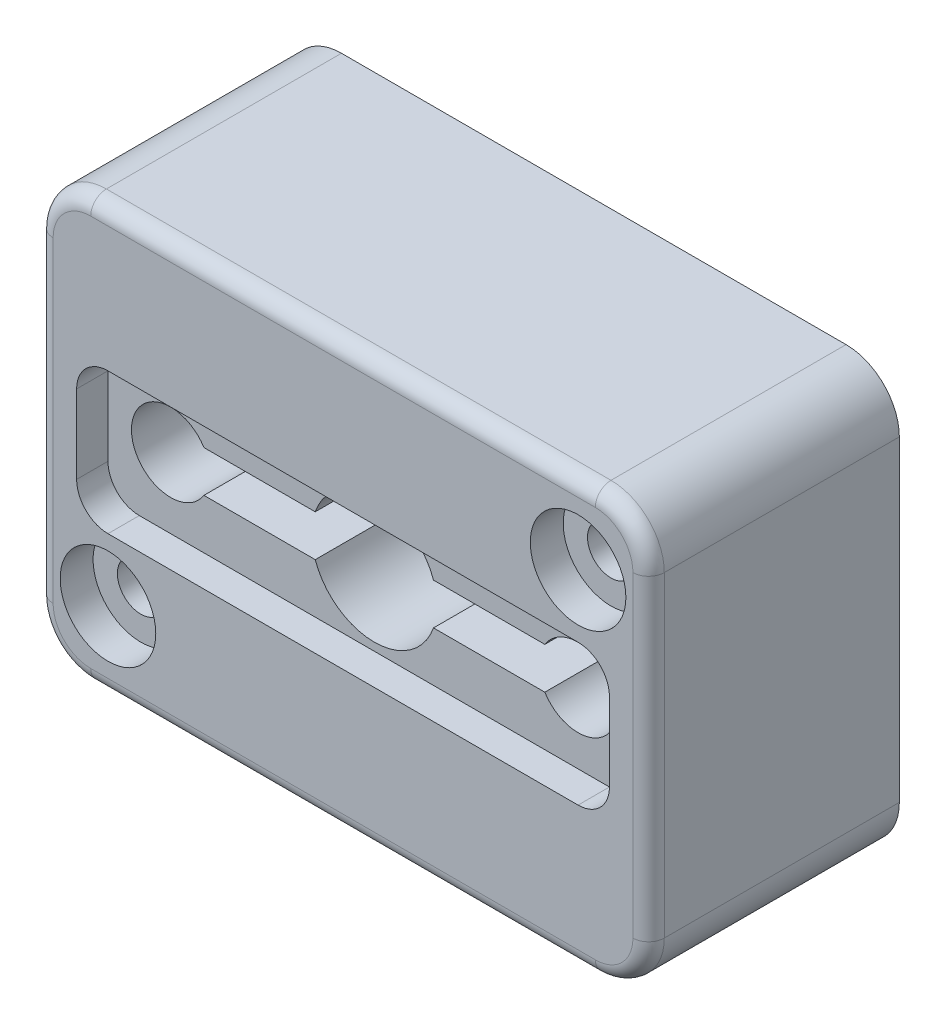
from build123d import *

# Parameters (mm, degrees)
SKIZZE1_R                       = 1.5
AUFSATZ_LINEAR_AUSTRAGEN1_DEPTH = 16
SCHNITT_LINEAR_AUSTRAGEN1_DEPTH = 2
SKIZZE3_R                       = 2.5
SCHNITT_LINEAR_AUSTRAGEN2_DEPTH = 7
SKIZZE4_R                       = 3.05
SCHNITT_LINEAR_AUSTRAGEN3_DEPTH = 2.1
VERRUNDUNG1_R                   = 1
SKIZZE5_R                       = 3.997213622
SCHNITT_LINEAR_AUSTRAGEN4_DEPTH = 28.540878708
SKIZZE6_W                       = 23.495930852
SKIZZE6_H                       = 2.64125978
SCHNITT_LINEAR_AUSTRAGEN5_DEPTH = 4


with BuildPart() as part:
    # Skizze1 → Aufsatz-Linear austragen1 (new body)
    with BuildSketch(Plane.XY):
        with BuildLine():
            Line((-16.1, 13.5), (16.1, 13.5))
            ThreePointArc((16.1, 13.5), (18.504163056, 12.504163056), (19.5, 10.1))
            Line((19.5, 10.1), (19.5, -10.1))
            ThreePointArc((19.5, -10.1), (18.504163056, -12.504163056), (16.1, -13.5))
            Line((16.1, -13.5), (-16.1, -13.5))
            ThreePointArc((-16.1, -13.5), (-18.504163056, -12.504163056), (-19.5, -10.1))
            Line((-19.5, -10.1), (-19.5, 10.1))
            ThreePointArc((-19.5, 10.1), (-18.504163056, 12.504163056), (-16.1, 13.5))
        make_face()
        with Locations((15, 8.5)):
            Circle(SKIZZE1_R, mode=Mode.SUBTRACT)
        with Locations((-15, -8.5)):
            Circle(SKIZZE1_R, mode=Mode.SUBTRACT)
    extrude(amount=AUFSATZ_LINEAR_AUSTRAGEN1_DEPTH)

    # Skizze2 → Schnitt-Linear austragen1 (cut)
    with BuildSketch(Plane.XY.offset(16)):
        with BuildLine():
            Line((-15, 4.5), (15, 4.5))
            ThreePointArc((15, 4.5), (16.414213562, 3.914213562), (17, 2.5))
            Line((17, 2.5), (17, -2.5))
            ThreePointArc((17, -2.5), (16.414213562, -3.914213562), (15, -4.5))
            Line((15, -4.5), (-15, -4.5))
            ThreePointArc((-15, -4.5), (-16.414213562, -3.914213562), (-17, -2.5))
            Line((-17, -2.5), (-17, 2.5))
            ThreePointArc((-17, 2.5), (-16.414213562, 3.914213562), (-15, 4.5))
        make_face()
    extrude(amount=-SCHNITT_LINEAR_AUSTRAGEN1_DEPTH, mode=Mode.SUBTRACT)

    # Skizze3 → Schnitt-Linear austragen2 (cut)
    with BuildSketch(Plane.XY.offset(14)):
        with Locations((-13, 0)):
            Circle(SKIZZE3_R)
        with Locations(Location((13, 0, 0), (0, 0, 180))):
            Circle(SKIZZE3_R)
    extrude(amount=-SCHNITT_LINEAR_AUSTRAGEN2_DEPTH, mode=Mode.SUBTRACT)

    # Skizze4 → Schnitt-Linear austragen3 (cut)
    with BuildSketch(Plane.XY.offset(16)):
        with Locations((15, 8.5)):
            Circle(SKIZZE4_R)
        with Locations((-15, -8.5)):
            Circle(SKIZZE4_R)
    extrude(amount=-SCHNITT_LINEAR_AUSTRAGEN3_DEPTH, mode=Mode.SUBTRACT)

    # Verrundung1
    verrundung1_edges = [part.edges().sort_by_distance(p)[0] for p in [
        (-18.504163056, 12.504163056, 16),
        (-19.5, 0, 16),
        (-18.504163056, -12.504163056, 16),
        (0, -13.5, 16),
        (18.504163056, -12.504163056, 16),
        (19.5, 0, 16),
        (18.504163056, 12.504163056, 16),
        (0, 13.5, 16),
    ]]
    fillet(verrundung1_edges, radius=VERRUNDUNG1_R)

    # Skizze5 → Schnitt-Linear austragen4 (cut, through all)
    with BuildSketch(Plane.XY.offset(14)):
        Circle(SKIZZE5_R)
    extrude(amount=-SCHNITT_LINEAR_AUSTRAGEN4_DEPTH, mode=Mode.SUBTRACT)

    # Skizze6 → Schnitt-Linear austragen5 (cut)
    with BuildSketch(Plane.XY.offset(14)):
        Rectangle(SKIZZE6_W, SKIZZE6_H)
    extrude(amount=-SCHNITT_LINEAR_AUSTRAGEN5_DEPTH, mode=Mode.SUBTRACT)


solid = part.part
